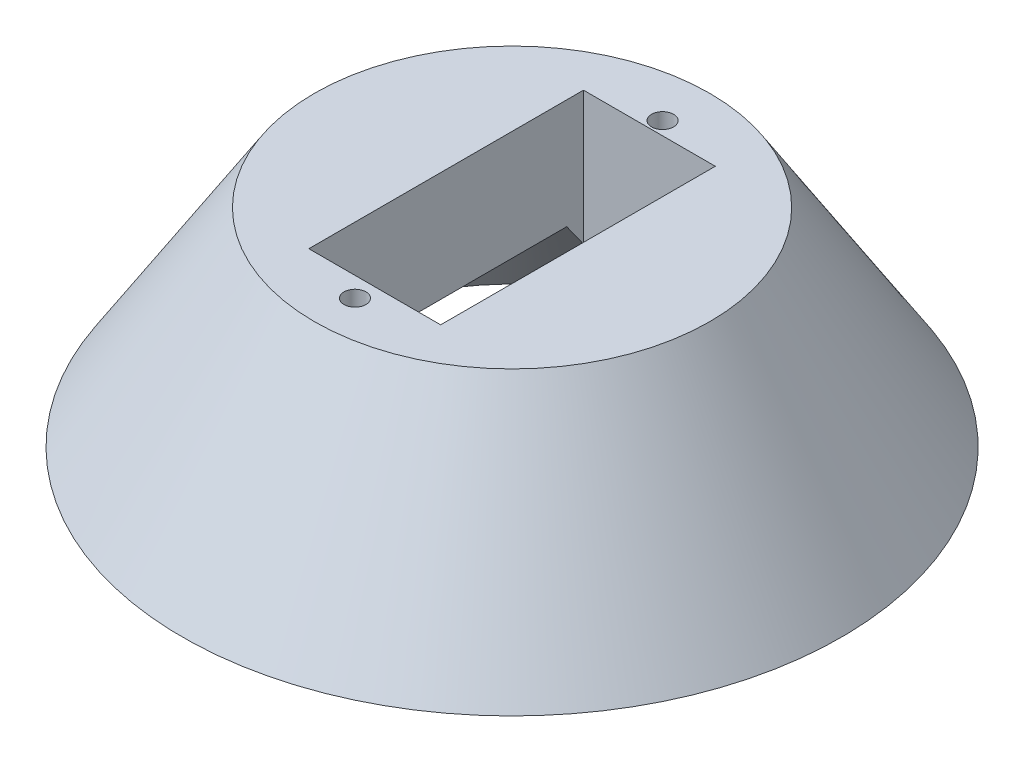
from build123d import *

# Parameters (mm, degrees)
SHELL2_T           = -10
SKETCH6_W          = 12
SKETCH6_H          = 25
CUT_EXTRUDE2_DEPTH = 47.434654221
SKETCH7_R          = 1
CUT_EXTRUDE3_DEPTH = 5


with BuildPart() as part:
    # Sketch5 → Revolve3 (revolve)
    with BuildSketch(Plane.XY, mode=Mode.PRIVATE) as revolve3_sk:
        Polygon((0, 0), (0, 18.872655155), (-18, 18.872655155), (-30, 0), align=None)
    revolve(revolve3_sk.sketch.rotate(Axis((0, 0, 0), (0, 1, 0)), 270), axis=Axis((0, 0, 0), (0, 1, 0)))

    # Shell2
    shell2_openings = [part.faces().sort_by_distance(p)[0] for p in [
        (0, 0, 0),
    ]]
    offset(amount=SHELL2_T, openings=shell2_openings, kind=Kind.INTERSECTION)

    # Sketch6 → Cut-Extrude2 (cut, through all)
    with BuildSketch(Plane(origin=(0, 18.872655155, 0), x_dir=(1, 0, 0), z_dir=(0, 1, 0))):
        Rectangle(SKETCH6_W, SKETCH6_H)
    extrude(amount=-CUT_EXTRUDE2_DEPTH, mode=Mode.SUBTRACT)

    # Sketch7 → Cut-Extrude3 (cut)
    with BuildSketch(Plane(origin=(0, 18.872655155, 0), x_dir=(1, 0, 0), z_dir=(0, 1, 0))):
        with Locations(Location((0, 13.7, 0), (0, 0, 270))):
            Circle(SKETCH7_R)
        with Locations(Location((0, -14.3, 0), (0, 0, 270))):
            Circle(SKETCH7_R)
    extrude(amount=-CUT_EXTRUDE3_DEPTH, mode=Mode.SUBTRACT)


solid = part.part
